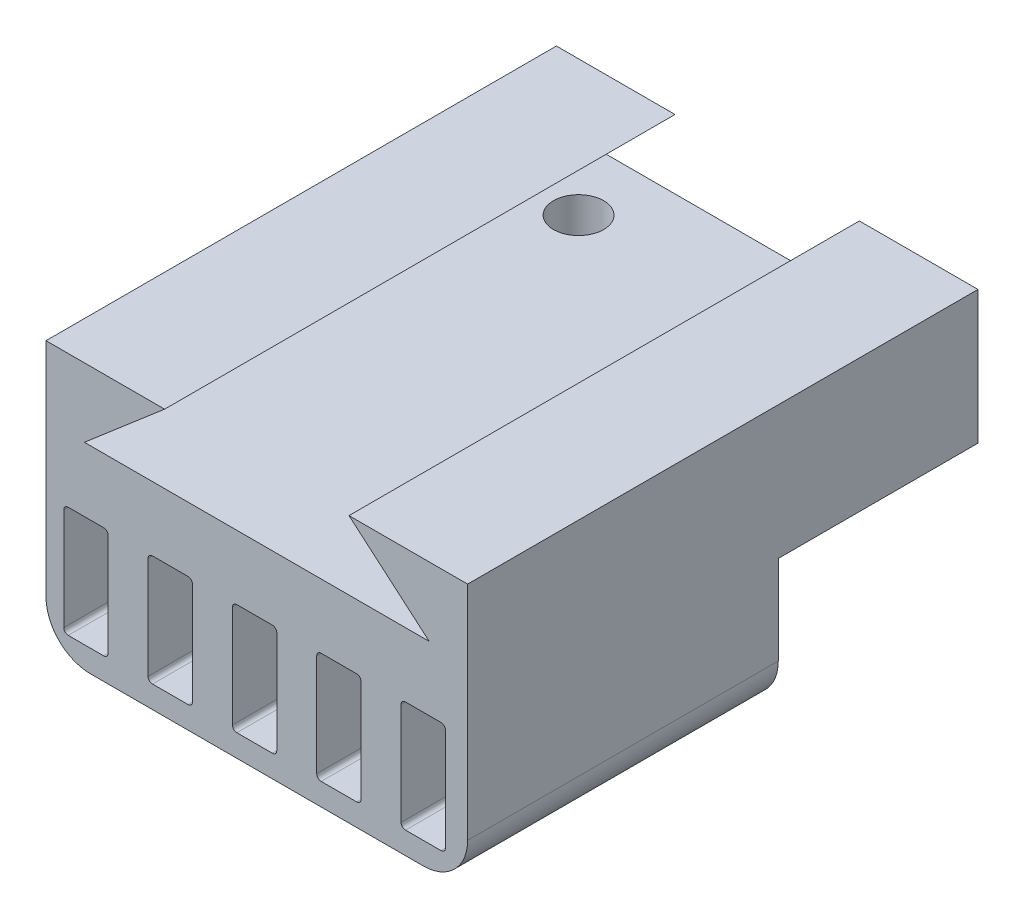
from build123d import *

# Parameters (mm, degrees)
BOSS_EXTRUDE2_DEPTH = 25.4
SKETCH3_W           = 24.13
SKETCH3_H           = 17.78
BOSS_EXTRUDE3_DEPTH = 7.62
CUT_EXTRUDE2_DEPTH  = 16.51
SKETCH5_R           = 1.143
CUT_EXTRUDE3_DEPTH  = 1.27
FILLET1_R           = 2.54
BOSS_EXTRUDE4_DEPTH = 3.81
SKETCH2_R           = 1.4351
CUT_EXTRUDE1_DEPTH  = 3.683


with BuildPart() as part:
    # Sketch1 → Boss-Extrude2 (new body)
    with BuildSketch(Plane.XY):
        Polygon((9.525, -21.59), (5.275147024, -21.59), (9.868313691, -25.527), (-9.868313691, -25.527), (-5.275147024, -21.59), (-9.525, -21.59), (-12.065, -21.59), (-12.065, -22.494104142), (-12.065, -29.21), (-8.343230433, -29.21), (10.89773699, -29.21), (12.065, -29.21), (12.065, -26.495103927), (12.065, -21.59), align=None)
    extrude(amount=BOSS_EXTRUDE2_DEPTH)

    # Sketch3 → Boss-Extrude3 (add)
    with BuildSketch(Plane(origin=(0, -29.21, 0), x_dir=(-1, 0, 0), z_dir=(0, -1, 0))):
        with Locations((0, -16.51)):
            Rectangle(SKETCH3_W, SKETCH3_H)
    extrude(amount=BOSS_EXTRUDE3_DEPTH)

    # Sketch4 → Cut-Extrude2 (cut)
    with BuildSketch(Plane.XY.offset(25.4)):
        with BuildLine():
            Line((10.541, -35.56), (8.509, -35.56))
            ThreePointArc((8.509, -35.56), (8.329394878, -35.485605122), (8.255, -35.306))
            Line((8.255, -35.306), (8.255, -29.464))
            ThreePointArc((8.255, -29.464), (8.329394878, -29.284394878), (8.509, -29.21))
            Line((8.509, -29.21), (10.541, -29.21))
            ThreePointArc((10.541, -29.21), (10.720605122, -29.284394878), (10.795, -29.464))
            Line((10.795, -29.464), (10.795, -35.306))
            ThreePointArc((10.795, -35.306), (10.720605122, -35.485605122), (10.541, -35.56))
        make_face()
        with BuildLine():
            Line((5.969, -35.306), (5.969, -29.464))
            ThreePointArc((5.969, -29.464), (5.894605122, -29.284394878), (5.715, -29.21))
            Line((5.715, -29.21), (3.683, -29.21))
            ThreePointArc((3.683, -29.21), (3.503394878, -29.284394878), (3.429, -29.464))
            Line((3.429, -29.464), (3.429, -35.306))
            ThreePointArc((3.429, -35.306), (3.503394878, -35.485605122), (3.683, -35.56))
            Line((3.683, -35.56), (5.715, -35.56))
            ThreePointArc((5.715, -35.56), (5.894605122, -35.485605122), (5.969, -35.306))
        make_face()
        with BuildLine():
            Line((1.143, -35.306), (1.143, -29.464))
            ThreePointArc((1.143, -29.464), (1.068605122, -29.284394878), (0.889, -29.21))
            Line((0.889, -29.21), (-1.143, -29.21))
            ThreePointArc((-1.143, -29.21), (-1.322605122, -29.284394878), (-1.397, -29.464))
            Line((-1.397, -29.464), (-1.397, -35.306))
            ThreePointArc((-1.397, -35.306), (-1.322605122, -35.485605122), (-1.143, -35.56))
            Line((-1.143, -35.56), (0.889, -35.56))
            ThreePointArc((0.889, -35.56), (1.068605122, -35.485605122), (1.143, -35.306))
        make_face()
        with BuildLine():
            Line((-3.683, -35.306), (-3.683, -29.464))
            ThreePointArc((-3.683, -29.464), (-3.757394878, -29.284394878), (-3.937, -29.21))
            Line((-3.937, -29.21), (-5.969, -29.21))
            ThreePointArc((-5.969, -29.21), (-6.148605122, -29.284394878), (-6.223, -29.464))
            Line((-6.223, -29.464), (-6.223, -35.306))
            ThreePointArc((-6.223, -35.306), (-6.148605122, -35.485605122), (-5.969, -35.56))
            Line((-5.969, -35.56), (-3.937, -35.56))
            ThreePointArc((-3.937, -35.56), (-3.757394878, -35.485605122), (-3.683, -35.306))
        make_face()
        with BuildLine():
            Line((-8.509, -35.306), (-8.509, -29.464))
            ThreePointArc((-8.509, -29.464), (-8.583394878, -29.284394878), (-8.763, -29.21))
            Line((-8.763, -29.21), (-10.795, -29.21))
            ThreePointArc((-10.795, -29.21), (-10.974605122, -29.284394878), (-11.049, -29.464))
            Line((-11.049, -29.464), (-11.049, -35.306))
            ThreePointArc((-11.049, -35.306), (-10.974605122, -35.485605122), (-10.795, -35.56))
            Line((-10.795, -35.56), (-8.763, -35.56))
            ThreePointArc((-8.763, -35.56), (-8.583394878, -35.485605122), (-8.509, -35.306))
        make_face()
    extrude(amount=-CUT_EXTRUDE2_DEPTH, mode=Mode.SUBTRACT)

    # Sketch5 → Cut-Extrude3 (cut)
    with BuildSketch(Plane.XY.offset(8.89)):
        with Locations((9.525, -32.385)):
            Circle(SKETCH5_R)
        with Locations((4.699, -32.385)):
            Circle(SKETCH5_R)
        with Locations((-0.127, -32.385)):
            Circle(SKETCH5_R)
        with Locations((-4.953, -32.385)):
            Circle(SKETCH5_R)
        with Locations((-9.779, -32.385)):
            Circle(SKETCH5_R)
    extrude(amount=-CUT_EXTRUDE3_DEPTH, mode=Mode.SUBTRACT)

    # Fillet1
    fillet1_edges = [part.edges().sort_by_distance(p)[0] for p in [
        (12.065, -36.83, 16.51),
        (-12.065, -36.83, 16.51),
    ]]
    fillet(fillet1_edges, radius=FILLET1_R)

    # Sketch6 → Boss-Extrude4 (add)
    with BuildSketch(Plane(origin=(0, 0, 0), x_dir=(-1, 0, 0), z_dir=(0, 0, -1))):
        Polygon((-12.065, -29.21), (12.065, -29.21), (12.065, -21.59), (5.275147024, -21.59), (9.868313691, -25.527), (-9.868313691, -25.527), (-5.275147024, -21.59), (-12.065, -21.59), align=None)
    extrude(amount=BOSS_EXTRUDE4_DEPTH)

    # Sketch2 → Cut-Extrude1 (cut)
    with BuildSketch(Plane(origin=(0, -29.21, 0), x_dir=(-1, 0, 0), z_dir=(0, -1, 0))):
        with Locations(Location((-6.985, 0, 0), (0, 0, 90))):
            Circle(SKETCH2_R)
        with Locations(Location((6.985, 0, 0), (0, 0, 90))):
            Circle(SKETCH2_R)
    extrude(amount=-CUT_EXTRUDE1_DEPTH, mode=Mode.SUBTRACT)


solid = part.part
